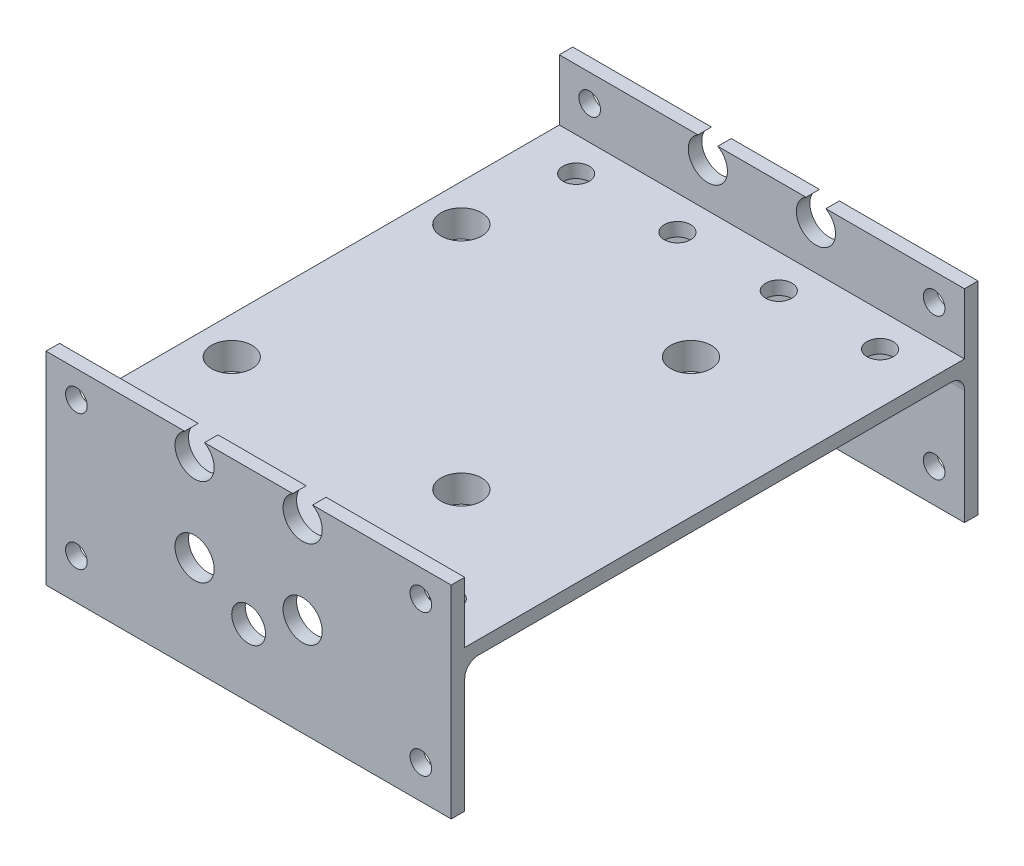
from build123d import *

# Parameters (mm, degrees)
SKETCH_1_W               = 60
SKETCH_1_H               = 78
EXTRUDE_1_DEPTH          = 2
SKETCH_2_R               = 2.1
CUT_EXTRUDE_1_DEPTH      = 12
EXTRUDE_2_DEPTH          = 2
SKETCH_4_R               = 1.6
CUT_EXTRUDE_2_DEPTH      = 126
SKETCH_5_R               = 1.946941413
CUT_EXTRUDE_3_DEPTH      = 10
SKETCH_6_R               = 4
SKETCH_6_R_2             = 2.1
EXTRUDE_3_DEPTH          = 5
FILLET_1_R               = 2
SKETCH_8_R               = 2.5
CUT_EXTRUDE_5_DEPTH      = 113
SKETCH_9_R               = 3
CUT_EXTRUDE_6_DEPTH      = 4
SKETCH_11_R              = 2.9
CUT_EXTRUDE_8_DEPTH      = 3.3
MIRROR_3_COPY_1_SKETCH_R = 2.9
MIRROR_3_COPY_1_DEPTH    = 3.3
SKETCH_12_R              = 2.9
CUT_EXTRUDE_9_DEPTH      = 87
SKETCH_13_R              = 2.9
CUT_EXTRUDE_10_DEPTH     = 87


with BuildPart() as part:
    # 草图1 → 凸台-拉伸1 (new body)
    with BuildSketch(Plane(origin=(0, 0, 0), x_dir=(1, 0, 0), z_dir=(0, 1, 0))):
        Rectangle(SKETCH_1_W, SKETCH_1_H)
    extrude(amount=EXTRUDE_1_DEPTH)

    # 草图2 → 切除-拉伸1 (cut)
    with BuildSketch(Plane(origin=(0, 2, 0), x_dir=(1, 0, 0), z_dir=(0, 1, 0))):
        with Locations(Location((-24.5, 17, 0), (0, 0, 270))):
            Circle(SKETCH_2_R)
        with Locations(Location((9.5, 17, 0), (0, 0, 270))):
            Circle(SKETCH_2_R)
        with Locations(Location((9.5, -17, 0), (0, 0, 90))):
            Circle(SKETCH_2_R)
        with Locations(Location((-24.5, -17, 0), (0, 0, 90))):
            Circle(SKETCH_2_R)
    extrude(amount=-CUT_EXTRUDE_1_DEPTH, mode=Mode.SUBTRACT)

    # 草图3 → 凸台-拉伸2 (add)
    with BuildSketch(Plane.XY.offset(39)):
        Polygon((-30, -9), (-30, 11), (30, 11), (30, -9), (30, -19), (-30, -19), align=None)
    extrude_2 = extrude(amount=-EXTRUDE_2_DEPTH)

    # 镜向1: 凸台-拉伸2 across plane
    add(extrude_2.mirror(Plane.XY))

    # 草图4 → 切除-拉伸2 (cut)
    with BuildSketch(Plane.XY.offset(39)):
        with Locations((-25.5, 7)):
            Circle(SKETCH_4_R)
        with Locations((25.5, 7)):
            Circle(SKETCH_4_R)
        with Locations((-25.5, -13)):
            Circle(SKETCH_4_R)
        with Locations((25.5, -14)):
            Circle(SKETCH_4_R)
    extrude(amount=-CUT_EXTRUDE_2_DEPTH, mode=Mode.SUBTRACT)

    # 草图5 → 切除-拉伸3 (cut)
    with BuildSketch(Plane(origin=(0, 2, 0), x_dir=(1, 0, 0), z_dir=(0, 1, 0))):
        with Locations(Location((-22.5, 32, 0), (0, 0, 270))):
            Circle(SKETCH_5_R)
        with Locations(Location((-7.5, 32, 0), (0, 0, 270))):
            Circle(SKETCH_5_R)
        with Locations(Location((7.5, 32, 0), (0, 0, 270))):
            Circle(SKETCH_5_R)
        with Locations(Location((22.5, 32, 0), (0, 0, 270))):
            Circle(SKETCH_5_R)
        with Locations(Location((22.5, -32, 0), (0, 0, 90))):
            Circle(SKETCH_5_R)
        with Locations(Location((7.5, -32, 0), (0, 0, 90))):
            Circle(SKETCH_5_R)
        with Locations(Location((-7.5, -32, 0), (0, 0, 90))):
            Circle(SKETCH_5_R)
        with Locations(Location((-22.5, -32, 0), (0, 0, 90))):
            Circle(SKETCH_5_R)
    extrude(amount=-CUT_EXTRUDE_3_DEPTH, mode=Mode.SUBTRACT)

    # 草图6 → 凸台-拉伸3 (add)
    # profile 1 of 4: a face of its own
    with BuildSketch(Plane(origin=(0, 2, 0), x_dir=(1, 0, 0), z_dir=(0, 1, 0))):
        with Locations(Location((-24.5, 17, 0), (0, 0, 270))):
            Circle(SKETCH_6_R)
        with Locations(Location((-24.5, 17, 0), (0, 0, 270))):
            Circle(SKETCH_6_R_2, mode=Mode.SUBTRACT)
    # profile 2 of 4: a face of its own
    with BuildSketch(Plane(origin=(0, 2, 0), x_dir=(1, 0, 0), z_dir=(0, 1, 0))):
        with Locations(Location((9.5, 17, 0), (0, 0, 270))):
            Circle(SKETCH_6_R)
        with Locations(Location((9.5, 17, 0), (0, 0, 270))):
            Circle(SKETCH_6_R_2, mode=Mode.SUBTRACT)
    # profile 3 of 4: a face of its own
    with BuildSketch(Plane(origin=(0, 2, 0), x_dir=(1, 0, 0), z_dir=(0, 1, 0))):
        with Locations(Location((-24.5, -17, 0), (0, 0, 270))):
            Circle(SKETCH_6_R)
        with Locations(Location((-24.5, -17, 0), (0, 0, 270))):
            Circle(SKETCH_6_R_2, mode=Mode.SUBTRACT)
    # profile 4 of 4: a face of its own
    with BuildSketch(Plane(origin=(0, 2, 0), x_dir=(1, 0, 0), z_dir=(0, 1, 0))):
        with Locations(Location((9.5, -17, 0), (0, 0, 270))):
            Circle(SKETCH_6_R)
        with Locations(Location((9.5, -17, 0), (0, 0, 270))):
            Circle(SKETCH_6_R_2, mode=Mode.SUBTRACT)
    extrude(amount=-EXTRUDE_3_DEPTH)

    # 圆角1
    fillet_1_edges = [part.edges().sort_by_distance(p)[0] for p in [
        (0, 0, 37),
        (0, 0, -37),
    ]]
    fillet(fillet_1_edges, radius=FILLET_1_R)

    # 草图8 → 切除-拉伸5 (cut)
    with BuildSketch(Plane(origin=(0, 0, -39), x_dir=(-1, 0, 0), z_dir=(0, 0, -1))):
        with Locations((0, -9)):
            Circle(SKETCH_8_R)
    extrude(amount=-CUT_EXTRUDE_5_DEPTH, mode=Mode.SUBTRACT)

    # 草图9 → 切除-拉伸6 (cut)
    with BuildSketch(Plane(origin=(0, 2, 0), x_dir=(1, 0, 0), z_dir=(0, 1, 0))):
        with Locations(Location((-24.5, -17, 0), (0, 0, 270))):
            Circle(SKETCH_9_R)
        with Locations(Location((9.5, -17, 0), (0, 0, 270))):
            Circle(SKETCH_9_R)
        with Locations(Location((-24.5, 17, 0), (0, 0, 270))):
            Circle(SKETCH_9_R)
        with Locations(Location((9.5, 17, 0), (0, 0, 270))):
            Circle(SKETCH_9_R)
    extrude(amount=-CUT_EXTRUDE_6_DEPTH, mode=Mode.SUBTRACT)

    # 草图11 → 切除-拉伸8 (cut)
    with BuildSketch(Plane(origin=(0, 0, -39), x_dir=(-1, 0, 0), z_dir=(0, 0, -1))):
        with Locations((-8, -4.5)):
            Circle(SKETCH_11_R)
    cut_extrude_8 = extrude(amount=-CUT_EXTRUDE_8_DEPTH, mode=Mode.SUBTRACT)

    # 镜向2: 切除-拉伸8 across plane
    add(cut_extrude_8.mirror(Plane(origin=(0, 0, 0), x_dir=(0, 0, 1), z_dir=(1, 0, 0))), mode=Mode.SUBTRACT)

    # 镜向3: 切除-拉伸8 across plane
    add(cut_extrude_8.mirror(Plane.XY), mode=Mode.SUBTRACT)

    # 镜向3 copy 1 sketch → 镜向3 copy 1 (cut)
    with BuildSketch(Plane.XY.offset(39)):
        with Locations((-8, -4.5)):
            Circle(MIRROR_3_COPY_1_SKETCH_R)
    extrude(amount=-MIRROR_3_COPY_1_DEPTH, mode=Mode.SUBTRACT)

    # 草图12 → 切除-拉伸9 (cut)
    with BuildSketch(Plane(origin=(0, 0, -39), x_dir=(-1, 0, 0), z_dir=(0, 0, -1))):
        with Locations((-8, 8.5)):
            Circle(SKETCH_12_R)
    extrude(amount=-CUT_EXTRUDE_9_DEPTH, mode=Mode.SUBTRACT)

    # 草图13 → 切除-拉伸10 (cut)
    with BuildSketch(Plane(origin=(0, 0, -39), x_dir=(-1, 0, 0), z_dir=(0, 0, -1))):
        with Locations((8, 8.5)):
            Circle(SKETCH_13_R)
    extrude(amount=-CUT_EXTRUDE_10_DEPTH, mode=Mode.SUBTRACT)


solid = part.part
